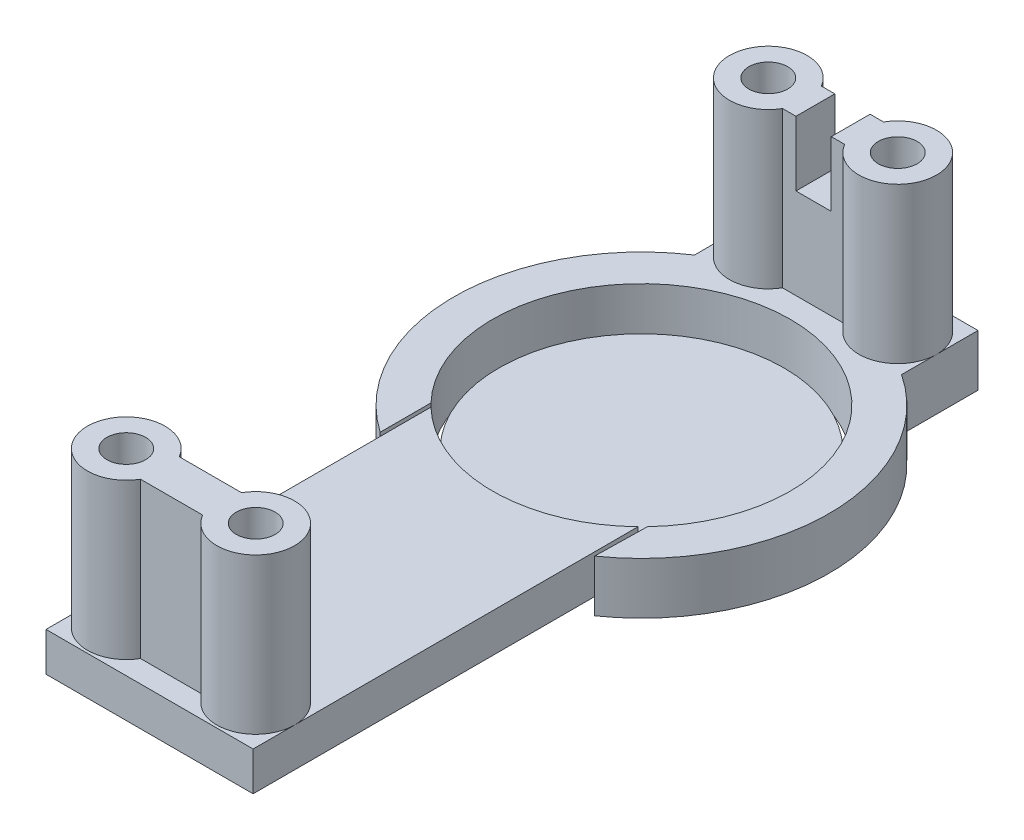
from build123d import *
from build123d.topology import SkipClean

# Parameters (mm, degrees)
SKETCH_1_W          = 16
SKETCH_1_H          = 56
SKETCH_1_R          = 1.5
EXTRUDE_1_DEPTH     = 3
SKETCH_2_R          = 3
SKETCH_2_R_2        = 1.5
EXTRUDE_3_DEPTH     = 12
EXTRUDE_4_DEPTH     = 3
CUT_EXTRUDE_START   = -3
SKETCH_5_R          = 11.5
CUT_EXTRUDE_1_DEPTH = 3
SKETCH_6_W          = 2.725103142
SKETCH_6_H          = 52.6
CUT_EXTRUDE_2_DEPTH = 5
SKETCH_7_R          = 1.5
SKETCH_7_R_2        = 11
EXTRUDE_5_DEPTH     = 1


with BuildPart() as part:
    # 草图1 → 凸台-拉伸1 (new body)
    with BuildSketch(Plane(origin=(0, 0, 0), x_dir=(1, 0, 0), z_dir=(0, 1, 0))):
        Rectangle(SKETCH_1_W, SKETCH_1_H)
        with Locations(Location((-5, 24.8, 0), (0, 0, 270))):
            Circle(SKETCH_1_R, mode=Mode.SUBTRACT)
        with Locations(Location((5, 24.8, 0), (0, 0, 270))):
            Circle(SKETCH_1_R, mode=Mode.SUBTRACT)
        with Locations(Location((5, -24.8, 0), (0, 0, 270))):
            Circle(SKETCH_1_R, mode=Mode.SUBTRACT)
        with Locations(Location((-5, -24.8, 0), (0, 0, 270))):
            Circle(SKETCH_1_R, mode=Mode.SUBTRACT)
    extrude(amount=EXTRUDE_1_DEPTH)

    # 草图2 → 凸台-拉伸3 (add)
    # profile 1 of 6: a face of its own
    with BuildSketch(Plane(origin=(0, 3, 0), x_dir=(1, 0, 0), z_dir=(0, 1, 0))):
        with Locations((-5, 24.8)):
            Circle(SKETCH_2_R)
        with Locations(Location((-5, 24.8, 0), (0, 0, 270))):
            Circle(SKETCH_2_R_2, mode=Mode.SUBTRACT)
    # profile 2 of 6: a face of its own
    with BuildSketch(Plane(origin=(0, 3, 0), x_dir=(1, 0, 0), z_dir=(0, 1, 0))):
        with BuildLine():
            Line((2.401923789, 26.3), (-2.401923789, 26.3))
            ThreePointArc((-2.401923789, 26.3), (-2.102222521, 25.576457135), (-2, 24.8))
            ThreePointArc((-2, 24.8), (-2.102222521, 24.023542865), (-2.401923789, 23.3))
            Line((-2.401923789, 23.3), (2.401923789, 23.3))
            ThreePointArc((2.401923789, 23.3), (2, 24.8), (2.401923789, 26.3))
        make_face()
    # profile 3 of 6: a face of its own
    with BuildSketch(Plane(origin=(0, 3, 0), x_dir=(1, 0, 0), z_dir=(0, 1, 0))):
        with Locations((5, 24.8)):
            Circle(SKETCH_2_R)
        with Locations(Location((5, 24.8, 0), (0, 0, 270))):
            Circle(SKETCH_2_R_2, mode=Mode.SUBTRACT)
    # profile 4 of 6: a face of its own
    with BuildSketch(Plane(origin=(0, 3, 0), x_dir=(1, 0, 0), z_dir=(0, 1, 0))):
        with Locations((-5, -24.8)):
            Circle(SKETCH_2_R)
        with Locations(Location((-5, -24.8, 0), (0, 0, 270))):
            Circle(SKETCH_2_R_2, mode=Mode.SUBTRACT)
    # profile 5 of 6: a face of its own
    with BuildSketch(Plane(origin=(0, 3, 0), x_dir=(1, 0, 0), z_dir=(0, 1, 0))):
        with BuildLine():
            Line((2.401923789, -23.3), (-2.401923789, -23.3))
            ThreePointArc((-2.401923789, -23.3), (-2.102222521, -24.023542865), (-2, -24.8))
            ThreePointArc((-2, -24.8), (-2.102222521, -25.576457135), (-2.401923789, -26.3))
            Line((-2.401923789, -26.3), (2.401923789, -26.3))
            ThreePointArc((2.401923789, -26.3), (2, -24.8), (2.401923789, -23.3))
        make_face()
    # profile 6 of 6: a face of its own
    with BuildSketch(Plane(origin=(0, 3, 0), x_dir=(1, 0, 0), z_dir=(0, 1, 0))):
        with Locations((5, -24.8)):
            Circle(SKETCH_2_R)
        with Locations(Location((5, -24.8, 0), (0, 0, 270))):
            Circle(SKETCH_2_R_2, mode=Mode.SUBTRACT)
    extrude(amount=EXTRUDE_3_DEPTH)

    # 草图3 → 凸台-拉伸4 (add)
    with BuildSketch(Plane(origin=(0, 3, 0), x_dir=(1, 0, 0), z_dir=(0, 1, 0))):
        with BuildLine():
            Line((8, 18.261355821), (8, 22.093386622))
            ThreePointArc((8, 22.093386622), (14.498972001, 10.172658335), (8.285714286, -1.899451196))
            Line((8.285714286, -1.899451196), (8.363636364, 2.106991272))
            ThreePointArc((8.363636364, 2.106991272), (11.497087555, 10.258800592), (8, 18.261355821))
        make_face()
        with BuildLine():
            Line((-8.285714286, -1.899451196), (-8.285714286, 2.025231115))
            ThreePointArc((-8.285714286, 2.025231115), (-11.498219811, 10.202339272), (-8, 18.261355821))
            Line((-8, 18.261355821), (-8, 22.093386622))
            ThreePointArc((-8, 22.093386622), (-14.498972001, 10.172658335), (-8.285714286, -1.899451196))
        make_face()
    extrude(amount=-EXTRUDE_4_DEPTH)

    # 草图5 → 切除-拉伸1 (cut)
    with SkipClean():  # the faces are left unmerged after this step: merging them gives an invalid solid
        with BuildSketch(Plane.XZ.offset(CUT_EXTRUDE_START)):
            with Locations((0, -10)):
                Circle(SKETCH_5_R)
        extrude(amount=CUT_EXTRUDE_1_DEPTH, mode=Mode.SUBTRACT)


with BuildPart() as cut_extrude_1_piece_1:
    # of the separate pieces the step leaves, piece 1, a body of its own (cut_extrude_1_pieces)
    add(part.part.solids().sort_by_distance((-8, 0, 28))[0])


with BuildPart() as cut_extrude_1_piece_2:
    # of the separate pieces the step leaves, piece 2, a body of its own (cut_extrude_1_pieces)
    add(part.part.solids().sort_by_distance((-8, 0, -28))[0])

    # 草图6 → 切除-拉伸2 (cut)
    with SkipClean():  # the faces are left unmerged after this step: merging them gives an invalid solid
        with BuildSketch(Plane(origin=(0, 15, 0), x_dir=(1, 0, 0), z_dir=(0, 1, 0))):
            Rectangle(SKETCH_6_W, SKETCH_6_H)
        extrude(amount=-CUT_EXTRUDE_2_DEPTH, mode=Mode.SUBTRACT)

    # 草图7 → 凸台-拉伸5 (add)
    # profile 1 of 4: a face of its own
    with BuildSketch(Plane.XZ):
        with Locations(Location((-5, 24.8, 0), (0, 0, 270))):
            Circle(SKETCH_7_R)
    # profile 2 of 4: a face of its own
    with BuildSketch(Plane.XZ):
        with Locations(Location((5, 24.8, 0), (0, 0, 270))):
            Circle(SKETCH_7_R)
    # profile 3 of 4: a face of its own
    with BuildSketch(Plane.XZ):
        with Locations(Location((0, -10, 0), (0, 0, 270))):
            Circle(SKETCH_7_R_2)
    # profile 4 of 4: a face of its own
    with BuildSketch(Plane.XZ):
        with BuildLine():
            Line((-8.285714286, -2.025231115), (-8.285714286, 1.899451196))
            ThreePointArc((-8.285714286, 1.899451196), (-14.498972001, -10.172658335), (-8, -22.093386622))
            Line((-8, -22.093386622), (-8, -28))
            Line((-8, -28), (8, -28))
            Line((8, -28), (8, -22.093386622))
            ThreePointArc((8, -22.093386622), (14.498972001, -10.172658335), (8.285714286, 1.899451196))
            Line((8.285714286, 1.899451196), (8.363636364, -2.106991272))
            ThreePointArc((8.363636364, -2.106991272), (-0.056472501, -21.499861341), (-8.285714286, -2.025231115))
        make_face()
        with Locations(Location((-5, -24.8, 0), (0, 0, 270))):
            Circle(SKETCH_7_R, mode=Mode.SUBTRACT)
        with Locations(Location((5, -24.8, 0), (0, 0, 270))):
            Circle(SKETCH_7_R, mode=Mode.SUBTRACT)
    extrude(amount=EXTRUDE_5_DEPTH)


with BuildPart() as extrude_5_piece_1:
    # of the separate pieces the step leaves, piece 1, a body of its own (extrude_5_pieces)
    add(cut_extrude_1_piece_2.part.solids().sort_by_distance((-8, 3, -28))[0])


with BuildPart() as extrude_5_piece_2:
    # of the separate pieces the step leaves, piece 2, a body of its own (extrude_5_pieces)
    add(cut_extrude_1_piece_2.part.solids().sort_by_distance((0, 0, -21))[0])


with BuildPart() as extrude_5_piece_3:
    # of the separate pieces the step leaves, piece 3, a body of its own (extrude_5_pieces)
    add(cut_extrude_1_piece_2.part.solids().sort_by_distance((-5, 0, 23.3))[0])


with BuildPart() as extrude_5_piece_4:
    # of the separate pieces the step leaves, piece 4, a body of its own (extrude_5_pieces)
    add(cut_extrude_1_piece_2.part.solids().sort_by_distance((5, 0, 23.3))[0])


solid = Compound([cut_extrude_1_piece_1.part, extrude_5_piece_1.part, extrude_5_piece_2.part, extrude_5_piece_3.part, extrude_5_piece_4.part])
